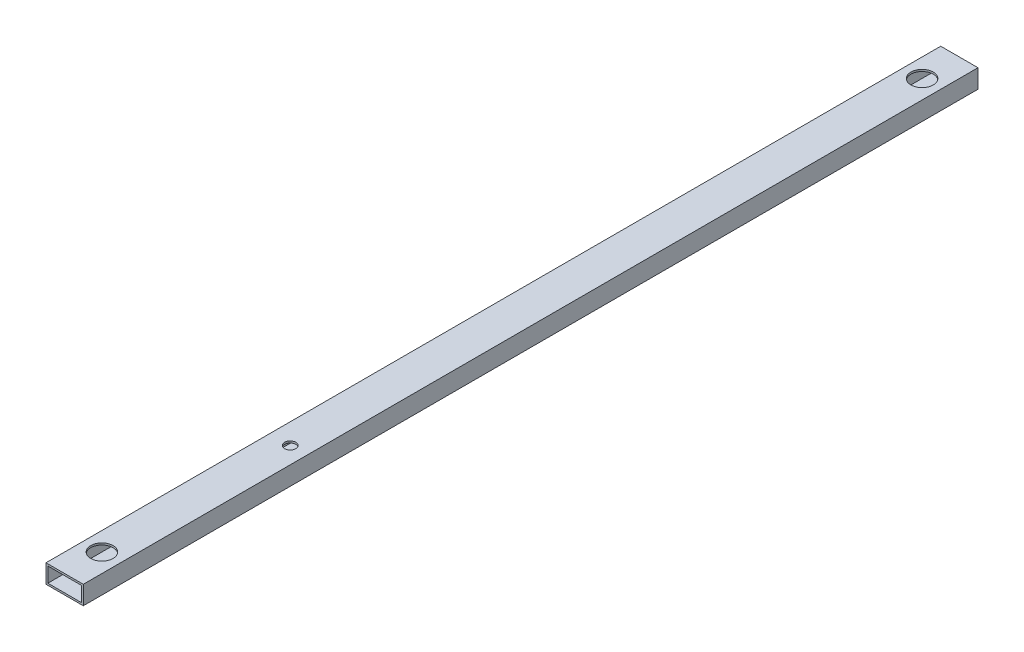
from build123d import *

# Parameters (mm, degrees)
SKETCH1_W               = 50
SKETCH1_H               = 25
BOSS_EXTRUDE1_DEPTH     = 1200
SHELL1_T                = -2.5
CUT_EXTRUDE1_DEPTH      = 1201.419015069
CUT_EXTRUDE1_DEPTH_BACK = 1201.419015069
SKETCH2_R               = 7.5
SKETCH3_R               = 15.00115
CUT_EXTRUDE2_DEPTH      = 1201.593177499


with BuildPart() as part:
    # Sketch1 → Boss-Extrude1 (new body)
    with BuildSketch(Plane.XY):
        with Locations((3.266196349, 1.88172043)):
            Rectangle(SKETCH1_W, SKETCH1_H)
    extrude(amount=BOSS_EXTRUDE1_DEPTH)

    # Shell1
    shell1_openings = [part.faces().sort_by_distance(p)[0] for p in [
        (3.266196349, 1.88172043, 1200),
        (3.266196349, 1.88172043, 0),
    ]]
    offset(amount=SHELL1_T, openings=shell1_openings, kind=Kind.INTERSECTION)

    # Sketch2 → Cut-Extrude1 (cut, two sides: drawn at the far end of the back side and taken through both)
    with BuildSketch(Plane(origin=(0, 0, 0), x_dir=(1, 0, 0), z_dir=(0, 1, 0)).offset(-CUT_EXTRUDE1_DEPTH_BACK)):
        with Locations(Location((5.766196349, -900, 0), (0, 0, 90))):
            Circle(SKETCH2_R)
    extrude(amount=CUT_EXTRUDE1_DEPTH + CUT_EXTRUDE1_DEPTH_BACK, mode=Mode.SUBTRACT)

    # Sketch3 → Cut-Extrude2 (cut, through all)
    with BuildSketch(Plane(origin=(0, 14.38172043, 0), x_dir=(1, 0, 0), z_dir=(0, 1, 0))):
        with Locations(Location((3.266196349, -50, 0), (0, 0, 270))):
            Circle(SKETCH3_R)
        with Locations(Location((3.266196349, -1150, 0), (0, 0, 270))):
            Circle(SKETCH3_R)
    extrude(amount=-CUT_EXTRUDE2_DEPTH, mode=Mode.SUBTRACT)


solid = part.part
